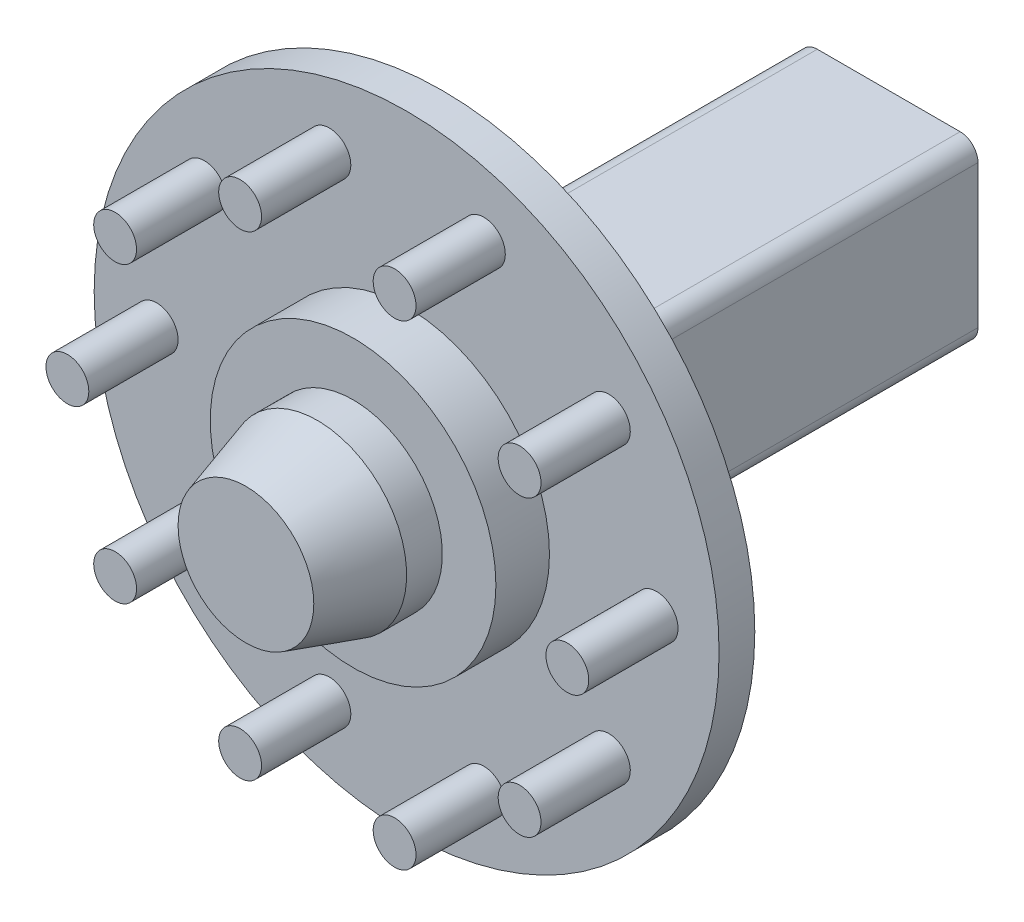
from build123d import *

# Parameters (mm, degrees)
EXTRUDE1_DEPTH    = 230
SKETCH2_R         = 50
EXTRUDE4_DEPTH    = 20
SKETCH5_R         = 175
EXTRUDE5_DEPTH    = 20
SKETCH6_R         = 50
EXTRUDE6_DEPTH    = 90
CHAMFER2_SIZE     = 40
CHAMFER2_SIZE2    = 12
SKETCH7_R         = 80
EXTRUDE7_DEPTH    = 30
SKETCH8_R         = 12
EXTRUDE8_DEPTH    = 50
CIRPATTERN1_COUNT = 10


with BuildPart() as part:
    # Sketch1 → Extrude1 (new body)
    with BuildSketch(Plane.XY):
        with BuildLine():
            Line((10, 0), (90, 0))
            ThreePointArc((90, 0), (97.071067812, 2.928932188), (100, 10))
            Line((100, 10), (100, 90))
            ThreePointArc((100, 90), (97.071067812, 97.071067812), (90, 100))
            Line((90, 100), (10, 100))
            ThreePointArc((10, 100), (2.928932188, 97.071067812), (0, 90))
            Line((0, 90), (0, 10))
            ThreePointArc((0, 10), (2.928932188, 2.928932188), (10, 0))
        make_face()
    extrude(amount=EXTRUDE1_DEPTH)

    # Sketch2 → Extrude4 (add)
    with BuildSketch(Plane.XY.offset(230)):
        with Locations((50, 50)):
            Circle(SKETCH2_R)
    extrude(amount=EXTRUDE4_DEPTH)

    # Sketch5 → Extrude5 (add)
    with BuildSketch(Plane.XY.offset(250)):
        with Locations((50, 50)):
            Circle(SKETCH5_R)
    extrude(amount=EXTRUDE5_DEPTH)

    # Sketch6 → Extrude6 (add)
    with BuildSketch(Plane.XY.offset(270)):
        with Locations((50, 50)):
            Circle(SKETCH6_R)
    extrude(amount=EXTRUDE6_DEPTH)

    # Chamfer2
    chamfer2_edges = [part.edges().sort_by_distance(p)[0] for p in [
        (0, 50, 360),
    ]]
    chamfer2_side = [part.faces().sort_by_distance(p)[0] for p in [
        (0, 50, 315),
    ]]
    chamfer(chamfer2_edges, length=CHAMFER2_SIZE, length2=CHAMFER2_SIZE2, reference=chamfer2_side[0])

    # Sketch7 → Extrude7 (add)
    with BuildSketch(Plane.XY.offset(270)):
        with Locations((50, 50)):
            Circle(SKETCH7_R)
    extrude(amount=EXTRUDE7_DEPTH)

    # Sketch8 → Extrude8 (add)
    with BuildSketch(Plane.XY.offset(270)):
        with Locations((-90, 50)):
            Circle(SKETCH8_R)
    extrude8 = extrude(amount=EXTRUDE8_DEPTH)

    # CirPattern1: Extrude8 ×10 about axis
    cirpattern1_axis = Axis((50, 50, 320), (0, 0, 1))
    for i in range(1, CIRPATTERN1_COUNT):
        add(extrude8.rotate(cirpattern1_axis, i * 360 / CIRPATTERN1_COUNT))


solid = part.part
